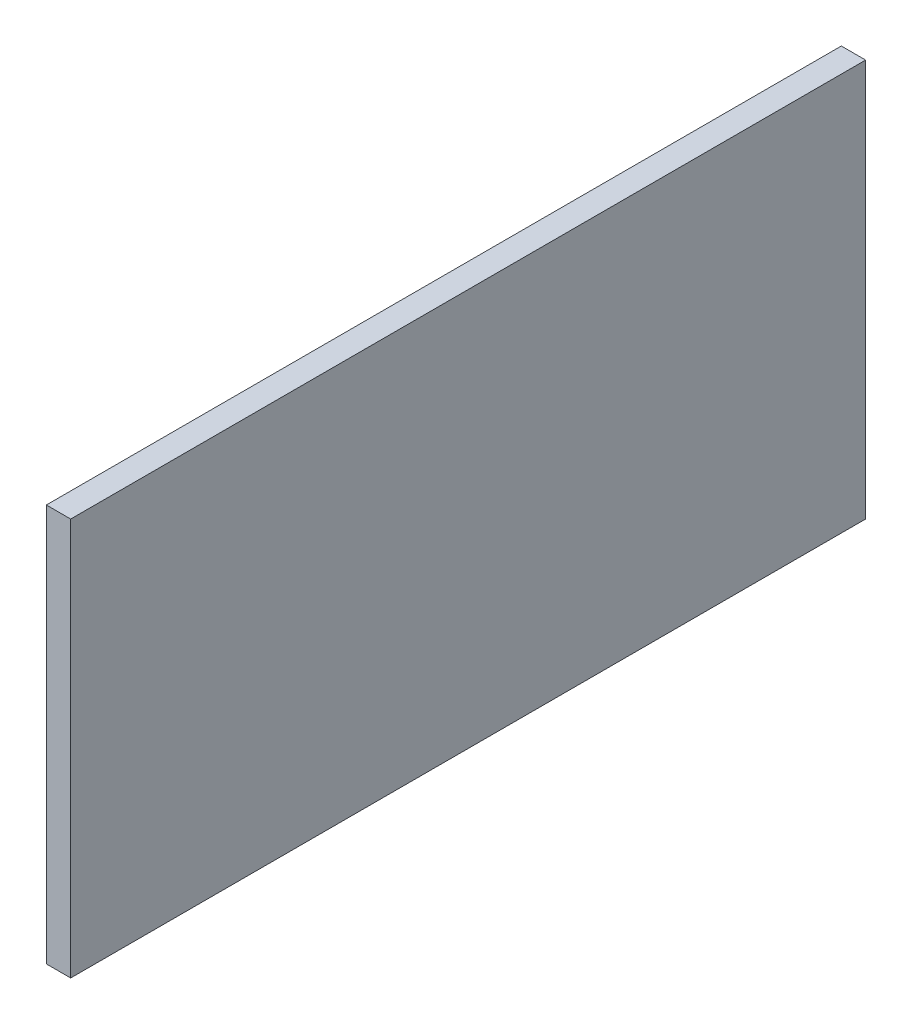
from build123d import *

# Parameters (mm, degrees)
SKETCH1_W           = 400
SKETCH1_H           = 200
BOSS_EXTRUDE1_DEPTH = 12.2428


with BuildPart() as part:
    # Sketch1 → Boss-Extrude1 (new body)
    with BuildSketch(Plane(origin=(0, 0, 0), x_dir=(0, 0, -1), z_dir=(1, 0, 0))):
        with Locations((0, -100)):
            Rectangle(SKETCH1_W, SKETCH1_H)
    extrude(amount=BOSS_EXTRUDE1_DEPTH)


solid = part.part
